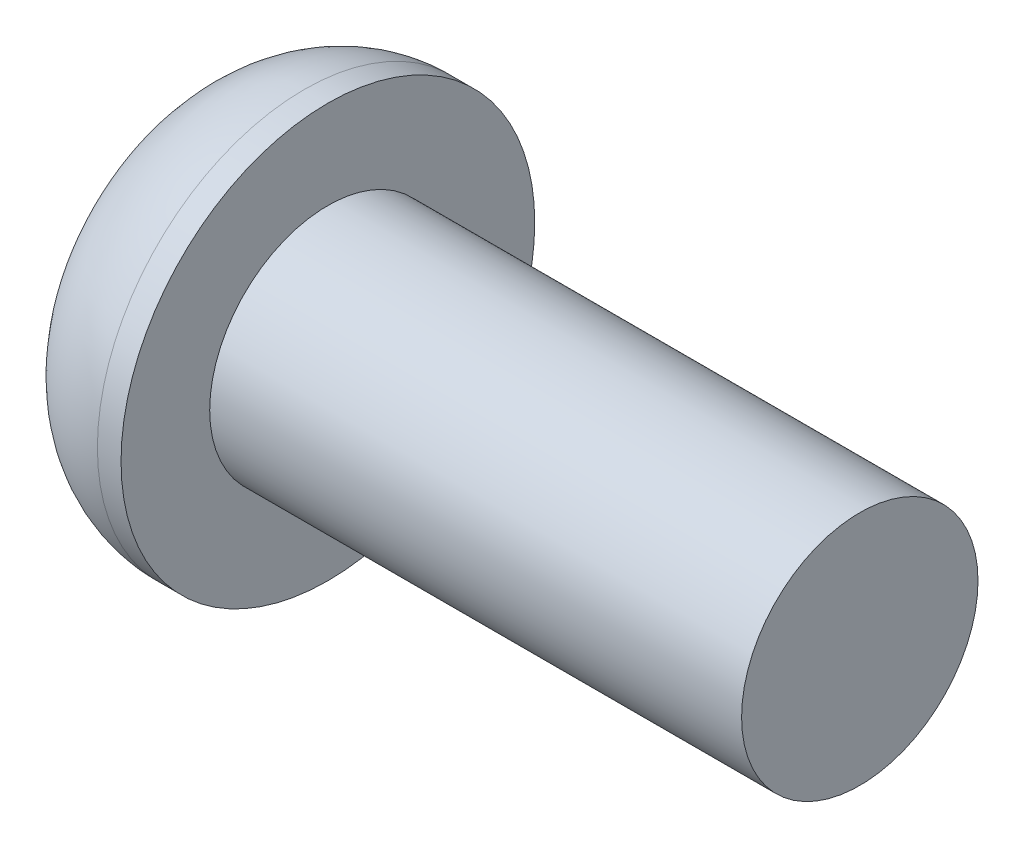
from build123d import *

# Parameters (mm, degrees)
CUT_EXTRUDE1_DEPTH = 4.2


with BuildPart() as part:
    # Sketch1 → Revolve1 (revolve)
    with BuildSketch(Plane.XY, mode=Mode.PRIVATE) as revolve1_sk:
        with BuildLine():
            Line((0, 0), (0, 2.8))
            ThreePointArc((0, 2.8), (1.230151519, 5.769848481), (4.2, 7))
            Line((4.2, 7), (5, 7))
            Line((5, 7), (5, 4))
            Line((5, 4), (23, 4))
            Line((23, 4), (23, 0))
            Line((23, 0), (0, 0))
        make_face()
    revolve(revolve1_sk.sketch.rotate(Axis((0, 0, 0), (-1, 0, 0)), 90), axis=Axis((0, 0, 0), (-1, 0, 0)))

    # Sketch2 → Cut-Extrude1 (cut)
    with BuildSketch(Plane.ZY):
        Polygon((2.886751346, 0), (1.443375673, 2.5), (-1.443375673, 2.5), (-2.886751346, 0), (-1.443375673, -2.5), (1.443375673, -2.5), align=None)
    extrude(amount=-CUT_EXTRUDE1_DEPTH, mode=Mode.SUBTRACT)


solid = part.part
